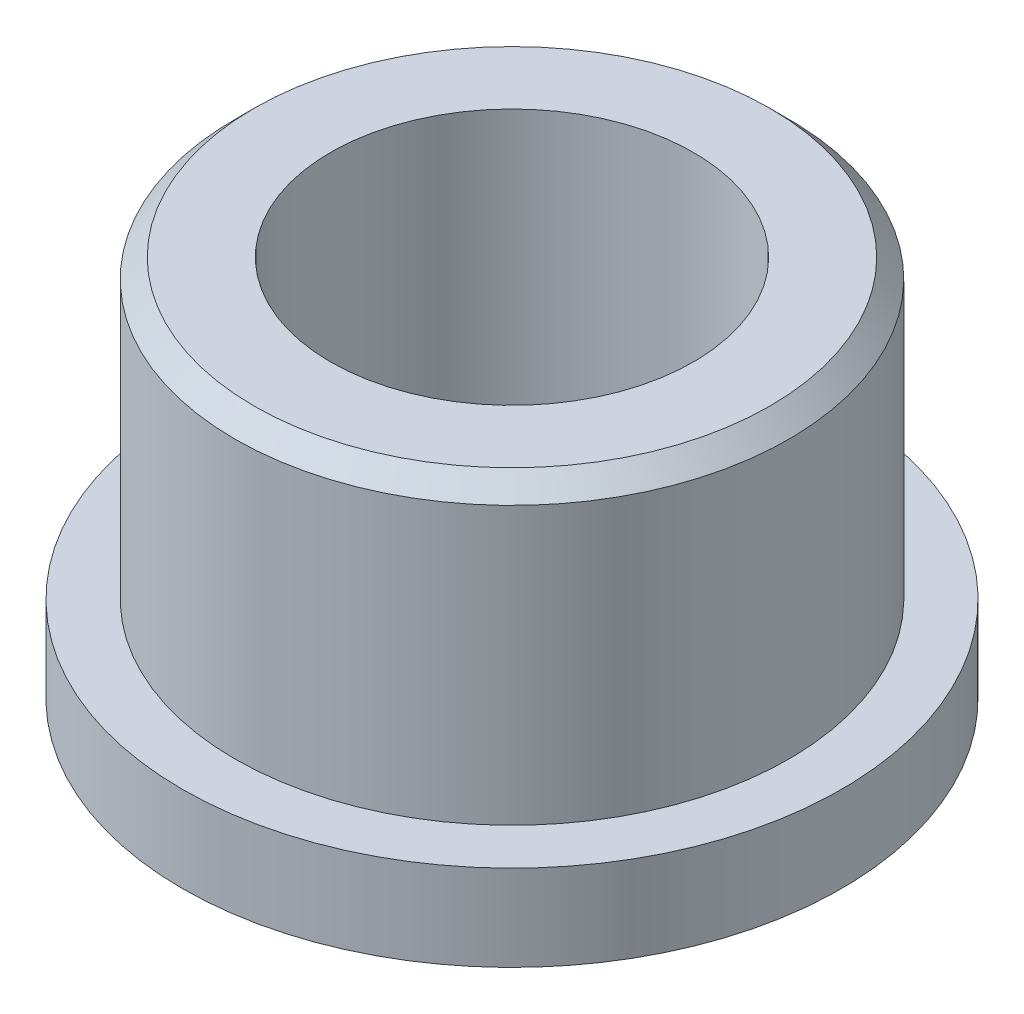
from build123d import *

# Parameters (mm, degrees)
SKETCH1_R           = 17.25
SKETCH1_R_2         = 9.5
BOSS_EXTRUDE1_DEPTH = 20
CUT_EXTRUDE1_START  = -15.5
SKETCH2_R           = 17.25
SKETCH2_R_2         = 14.5
CUT_EXTRUDE1_DEPTH  = 15.5
CHAMFER1_SIZE       = 1


with BuildPart() as part:
    # Sketch1 → Boss-Extrude1 (new body)
    with BuildSketch(Plane(origin=(0, 0, 0), x_dir=(1, 0, 0), z_dir=(0, 1, 0))):
        with Locations(Location((0, 0, 0), (0, 0, 270))):
            Circle(SKETCH1_R)
        with Locations(Location((0, 0, 0), (0, 0, 270))):
            Circle(SKETCH1_R_2, mode=Mode.SUBTRACT)
    extrude(amount=BOSS_EXTRUDE1_DEPTH)

    # Sketch2 → Cut-Extrude1 (cut)
    with BuildSketch(Plane(origin=(0, 20, 0), x_dir=(1, 0, 0), z_dir=(0, 1, 0)).offset(CUT_EXTRUDE1_START)):
        with Locations(Location((0, 0, 0), (0, 0, 270))):
            Circle(SKETCH2_R)
        with Locations(Location((0, 0, 0), (0, 0, 270))):
            Circle(SKETCH2_R_2, mode=Mode.SUBTRACT)
    extrude(amount=CUT_EXTRUDE1_DEPTH, mode=Mode.SUBTRACT)

    # Chamfer1
    chamfer1_edges = [part.edges().sort_by_distance(p)[0] for p in [
        (0, 20, -14.5),
    ]]
    chamfer(chamfer1_edges, length=CHAMFER1_SIZE)


solid = part.part
